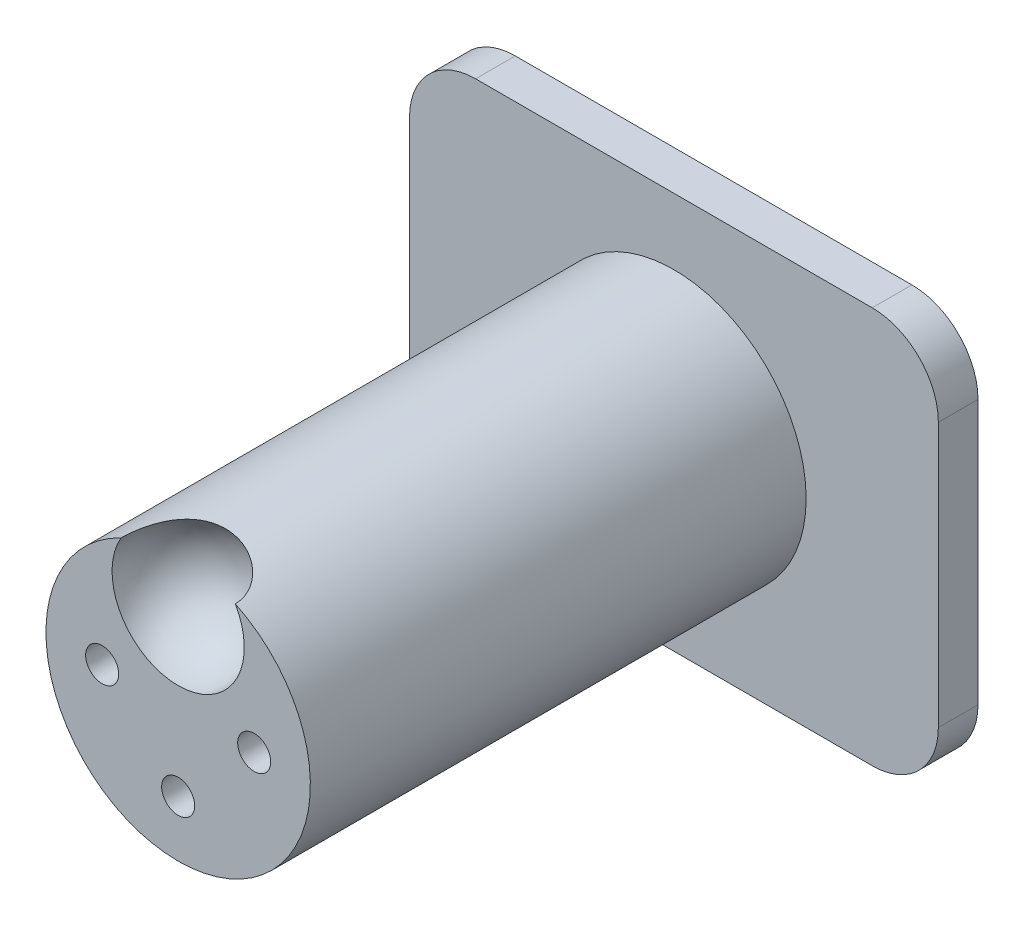
from build123d import *

# Parameters (mm, degrees)
SKETCH_1_W          = 80
SKETCH_1_H          = 60
EXTRUDE_1_DEPTH     = 6
SKETCH_2_R          = 20
EXTRUDE_2_DEPTH     = 75
SKETCH_7_R          = 2.5
CUT_EXTRUDE_2_DEPTH = 20
FILLET_1_R          = 10
CUT_REVOLVE_1_ANGLE = 180


with BuildPart() as part:
    # 草图1 → 凸台-拉伸1 (new body)
    with BuildSketch(Plane.XY):
        with Locations((-9.9578316, -5)):
            Rectangle(SKETCH_1_W, SKETCH_1_H)
    extrude(amount=EXTRUDE_1_DEPTH)

    # 草图2 → 凸台-拉伸2 (add)
    with BuildSketch(Plane.XY.offset(6)):
        with Locations((-9.9578316, -5)):
            Circle(SKETCH_2_R)
    extrude(amount=EXTRUDE_2_DEPTH)

    # 草图7 → 切除-拉伸2 (cut)
    with BuildSketch(Plane.XY.offset(81)):
        with Locations((-9.9578316, -16.5)):
            Circle(SKETCH_7_R)
        with Locations((-21.4578316, -5)):
            Circle(SKETCH_7_R)
        with Locations((1.5421684, -5)):
            Circle(SKETCH_7_R)
    extrude(amount=-CUT_EXTRUDE_2_DEPTH, mode=Mode.SUBTRACT)

    # 圆角1
    fillet_1_edges = [part.edges().sort_by_distance(p)[0] for p in [
        (30.0421684, -35, 3),
        (-49.9578316, -35, 3),
        (-49.9578316, 25, 3),
        (30.0421684, 25, 3),
    ]]
    fillet(fillet_1_edges, radius=FILLET_1_R)

    # 草图4 → 切除-旋转1 (revolve, cut)
    with BuildSketch(Plane.XY.offset(81)):
        with BuildLine():
            Line((-9.9578316, -2), (-9.9578316, 18))
            ThreePointArc((-9.9578316, 18), (0.0421684, 8), (-9.9578316, -2))
        make_face()
    revolve(axis=Axis((-9.9578316, -2, 81), (0, 1, 0)), revolution_arc=CUT_REVOLVE_1_ANGLE, mode=Mode.SUBTRACT)


solid = part.part
